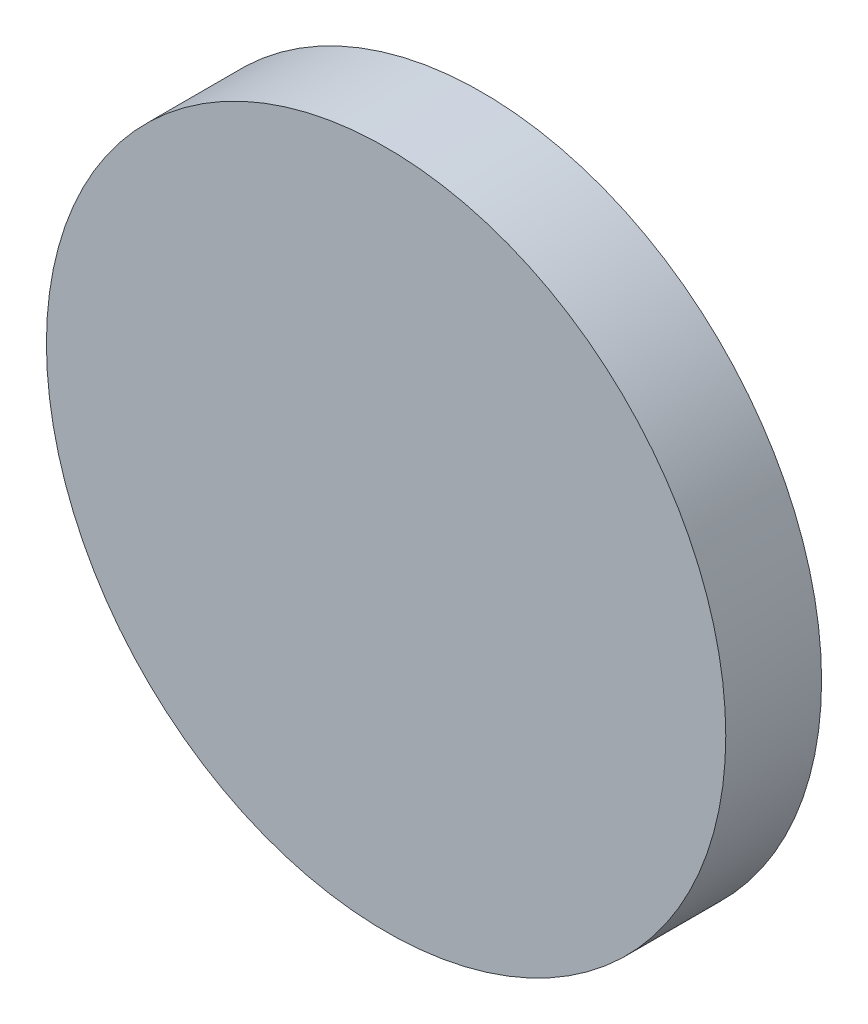
from build123d import *

# Parameters (mm, degrees)
SKETCH_1_R      = 35.455812903
EXTRUDE_1_DEPTH = 10


with BuildPart() as part:
    # 草图1 → 凸台-拉伸1 (new body)
    with BuildSketch(Plane.XY):
        Circle(SKETCH_1_R)
    extrude(amount=EXTRUDE_1_DEPTH)


solid = part.part
